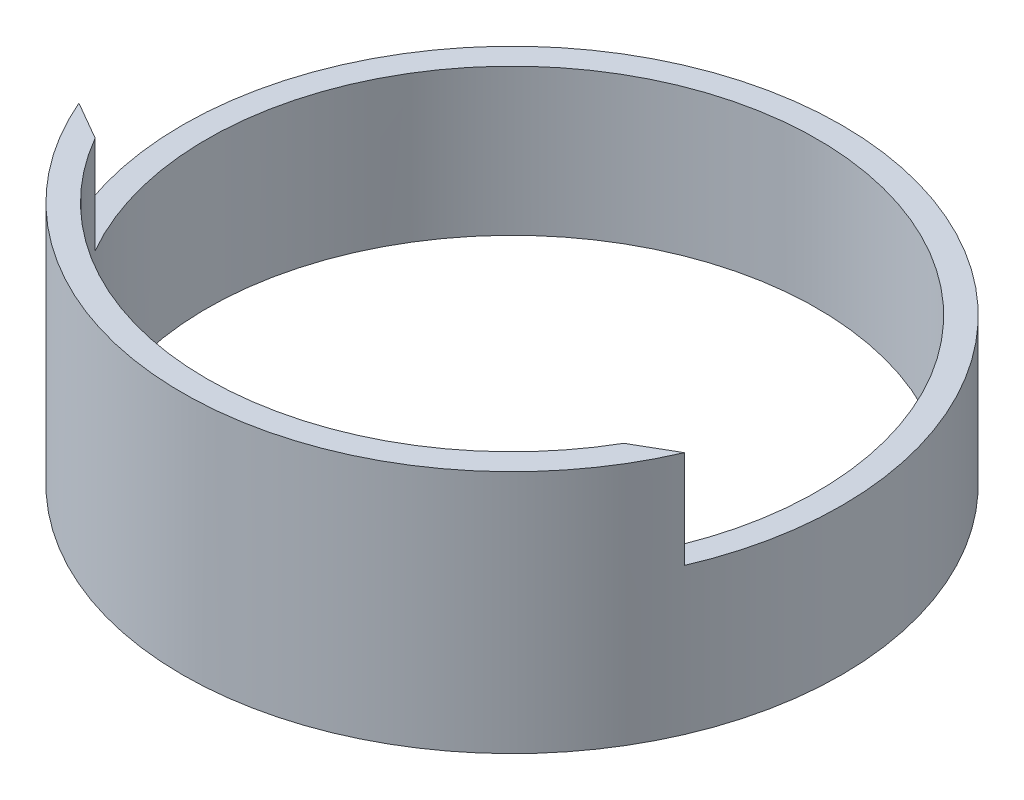
from build123d import *

# Parameters (mm, degrees)
SKETCH1_R           = 13.5
SKETCH1_R_2         = 12.5
BOSS_EXTRUDE1_DEPTH = 10
CUT_EXTRUDE1_DEPTH  = 4


with BuildPart() as part:
    # Sketch1 → Boss-Extrude1 (new body)
    with BuildSketch(Plane(origin=(0, 0, 0), x_dir=(1, 0, 0), z_dir=(0, 1, 0))):
        with Locations(Location((0, 0, 0), (0, 0, 270))):
            Circle(SKETCH1_R)
        with Locations(Location((0, 0, 0), (0, 0, 270))):
            Circle(SKETCH1_R_2, mode=Mode.SUBTRACT)
    extrude(amount=BOSS_EXTRUDE1_DEPTH)

    # Sketch2 → Cut-Extrude1 (cut)
    with BuildSketch(Plane(origin=(0, 10, 0), x_dir=(1, 0, 0), z_dir=(0, 1, 0))):
        Polygon((-45.033320997, 13.5), (0, -12.5), (45.033320997, 13.5), align=None)
    extrude(amount=-CUT_EXTRUDE1_DEPTH, mode=Mode.SUBTRACT)


solid = part.part
